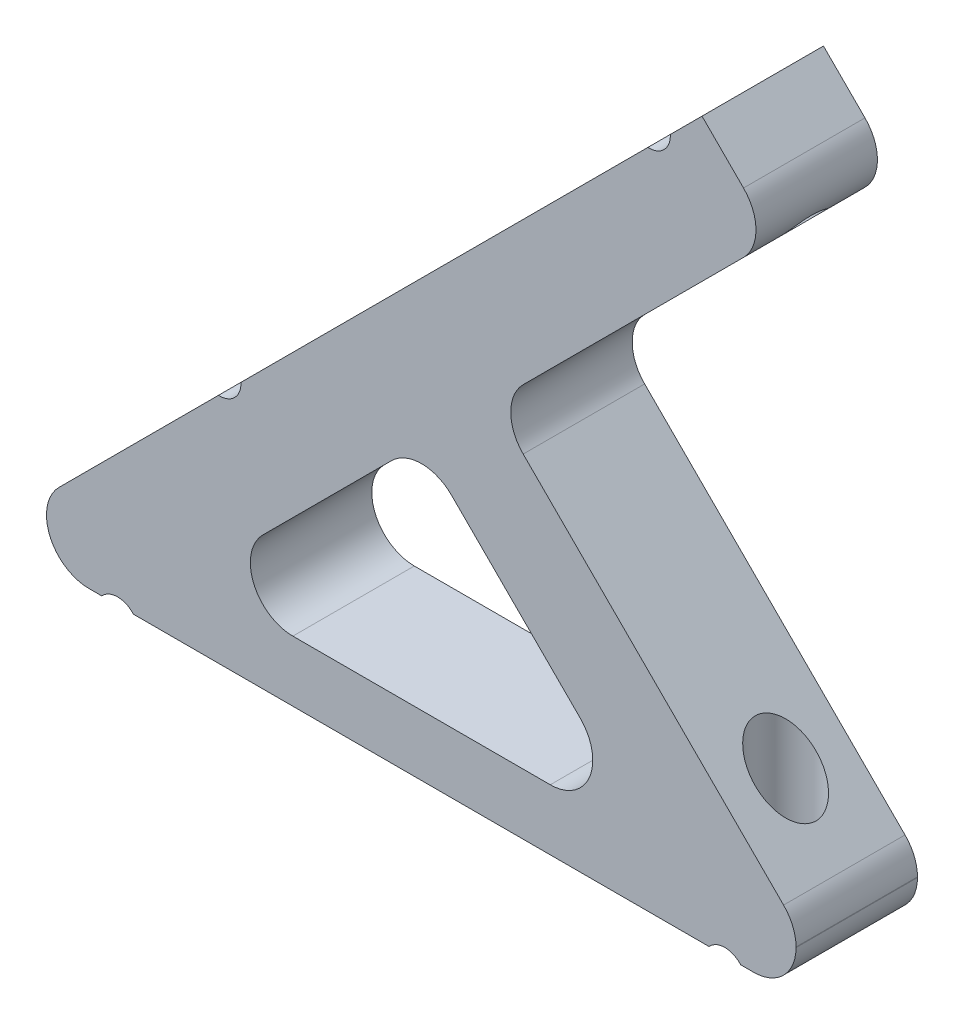
from build123d import *

# Parameters (mm, degrees)
EXTRUDE_1_DEPTH     = 6
FILLET_1_R          = 2.1
SKETCH_2_R          = 1.05
CUT_EXTRUDE_1_DEPTH = 52.548347418
CUT_EXTRUDE_2_REACH = 30.914
SKETCH_3_R          = 1.5
CUT_EXTRUDE_3_REACH = 53.548
SKETCH_4_R          = 1.5


with BuildPart() as part:
    # ｽｹｯﾁ1 → ﾎﾞｽ - 押し出し1 (new body)
    with BuildSketch(Plane.XY):
        Polygon((0, 0), (-40, 0), (-4.644660941, 35.355339059), (-1.109127035, 31.819805153), (-14.964466094, 17.964466094), (0, 3), align=None)
        Polygon((-18.5, 14.428932188), (-29.928932188, 3), (-7.071067812, 3), align=None, mode=Mode.SUBTRACT)
    extrude(amount=EXTRUDE_1_DEPTH)

    # ﾌｨﾚｯﾄ1
    fillet_1_edges = [part.edges().sort_by_distance(p)[0] for p in [
        (0, 0, 3),
        (-40, 0, 3),
        (-1.109127035, 31.819805153, 3),
        (-14.964466094, 17.964466094, 3),
        (0, 3, 3),
        (-7.071067812, 3, 3),
        (-18.5, 14.428932188, 3),
        (-29.928932188, 3, 3),
    ]]
    fillet(fillet_1_edges, radius=FILLET_1_R)

    # ｽｹｯﾁ2 → ｶｯﾄ - 押し出し1 (cut, through all)
    with BuildSketch(Plane.XY.offset(6)):
        with Locations((-33.51507576, -0.7)):
            Circle(SKETCH_2_R)
        with Locations((-3.51507576, -0.7)):
            Circle(SKETCH_2_R)
        with Locations((-7.260956031, 33.728993463)):
            Circle(SKETCH_2_R)
        with Locations((-28.474159467, 12.515790027)):
            Circle(SKETCH_2_R)
    extrude(amount=-CUT_EXTRUDE_1_DEPTH, mode=Mode.SUBTRACT)

    # ｽｹｯﾁ3 → ｶｯﾄ - 押し出し2 (cut, up to next)
    with BuildSketch(Plane(origin=(-20, 20, 0), x_dir=(0, 0, 1), z_dir=(-0.7071067811865439, 0.7071067811865511, 0)), mode=Mode.PRIVATE) as cut_extrude_2_sk1:
        with Locations(Location((3, 18.715728753, 0), (0, 0, 328.550342674))):
            Circle(SKETCH_3_R)
    cut_extrude_2_tool1 = extrude(cut_extrude_2_sk1.sketch, amount=-CUT_EXTRUDE_2_REACH, mode=Mode.PRIVATE) & part.part
    # ｽｹｯﾁ3 → ｶｯﾄ - 押し出し2 (cut, up to next)
    with BuildSketch(Plane(origin=(-20, 20, 0), x_dir=(0, 0, 1), z_dir=(-0.7071067811865439, 0.7071067811865511, 0)), mode=Mode.PRIVATE) as cut_extrude_2_sk2:
        with Locations(Location((3, -11.284271247, 0), (0, 0, 211.449657326))):
            Circle(SKETCH_3_R)
    cut_extrude_2_tool2 = extrude(cut_extrude_2_sk2.sketch, amount=-CUT_EXTRUDE_2_REACH, mode=Mode.PRIVATE) & part.part
    add(cut_extrude_2_tool1.solids().sort_by_distance((-6.765981, 33.234019, 3))[0], mode=Mode.SUBTRACT)
    add(cut_extrude_2_tool2.solids().sort_by_distance((-27.979185, 12.020815, 3))[0], mode=Mode.SUBTRACT)

    # ｽｹｯﾁ4 → ｶｯﾄ - 押し出し3 (cut, up to next)
    with BuildSketch(Plane.XZ, mode=Mode.PRIVATE) as cut_extrude_3_sk1:
        with Locations(Location((-33.51507576, 3, 0), (0, 0, 58.550342674))):
            Circle(SKETCH_4_R)
    cut_extrude_3_tool1 = extrude(cut_extrude_3_sk1.sketch, amount=-CUT_EXTRUDE_3_REACH, mode=Mode.PRIVATE) & part.part
    # ｽｹｯﾁ4 → ｶｯﾄ - 押し出し3 (cut, up to next)
    with BuildSketch(Plane.XZ, mode=Mode.PRIVATE) as cut_extrude_3_sk2:
        with Locations((-3.51507576, 3)):
            Circle(SKETCH_4_R)
    cut_extrude_3_tool2 = extrude(cut_extrude_3_sk2.sketch, amount=-CUT_EXTRUDE_3_REACH, mode=Mode.PRIVATE) & part.part
    add(cut_extrude_3_tool1.solids().sort_by_distance((-33.515076, 0, 3))[0], mode=Mode.SUBTRACT)
    add(cut_extrude_3_tool2.solids().sort_by_distance((-3.515076, 0, 3))[0], mode=Mode.SUBTRACT)


solid = part.part
